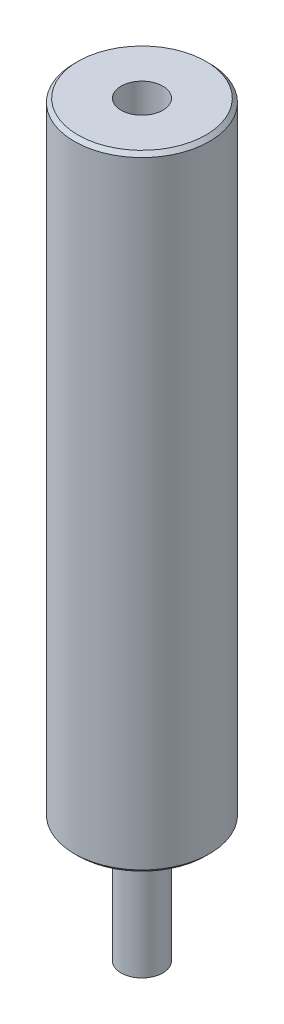
from build123d import *


with BuildPart() as part:
    # Esboço1 → Revolução1 (revolve)
    with BuildSketch(Plane(origin=(0, 0, 0), x_dir=(-1, 0, 0), z_dir=(0, 0, -1)), mode=Mode.PRIVATE) as revolu_o1_sk:
        with BuildLine():
            Line((-1.7, 0), (0, 0))
            Line((0, 0), (0, 50.8))
            Line((0, 50.8), (-1.7, 50.8))
            Line((-1.7, 50.8), (-1.7, 60.8))
            Line((-1.7, 60.8), (-5.2, 60.8))
            Line((-5.2, 60.8), (-5.5, 60.5))
            Line((-5.5, 60.5), (-5.5, 10.3))
            Line((-5.5, 10.3), (-5.2, 10))
            Line((-5.2, 10), (-2.2, 10))
            ThreePointArc((-2.2, 10), (-1.846446609, 9.853553391), (-1.7, 9.5))
            Line((-1.7, 9.5), (-1.7, 0))
        make_face()
    revolve(revolu_o1_sk.sketch.rotate(Axis((0, 0, 0), (0, 1, 0)), 270), axis=Axis((0, 0, 0), (0, 1, 0)))


solid = part.part
